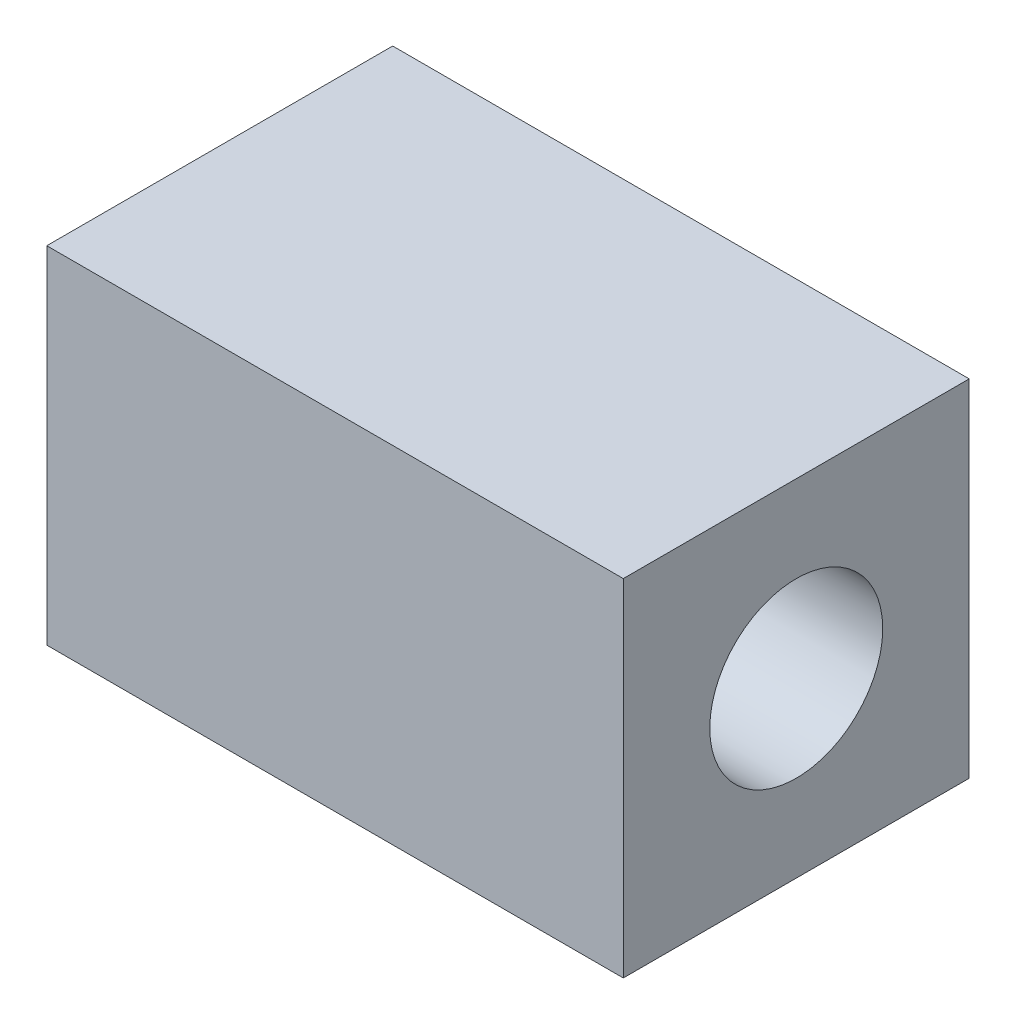
from build123d import *

# Parameters (mm, degrees)
CROQUIS1_W              = 50
CROQUIS1_H              = 30
SALIENTE_EXTRUIR1_DEPTH = 15
CROQUIS2_R              = 7.5
CORTAR_EXTRUIR1_DEPTH   = 55.313902456


with BuildPart() as part:
    # Croquis1 → Saliente-Extruir1 (new, symmetric)
    with BuildSketch(Plane.XY):
        with Locations((-64.227817577, 0)):
            Rectangle(CROQUIS1_W, CROQUIS1_H)
    extrude(amount=SALIENTE_EXTRUIR1_DEPTH, both=True)

    # Croquis2 → Cortar-Extruir1 (cut, through all)
    with BuildSketch(Plane.ZY.offset(89.227817577)):
        Circle(CROQUIS2_R)
    extrude(amount=-CORTAR_EXTRUIR1_DEPTH, mode=Mode.SUBTRACT)


solid = part.part
